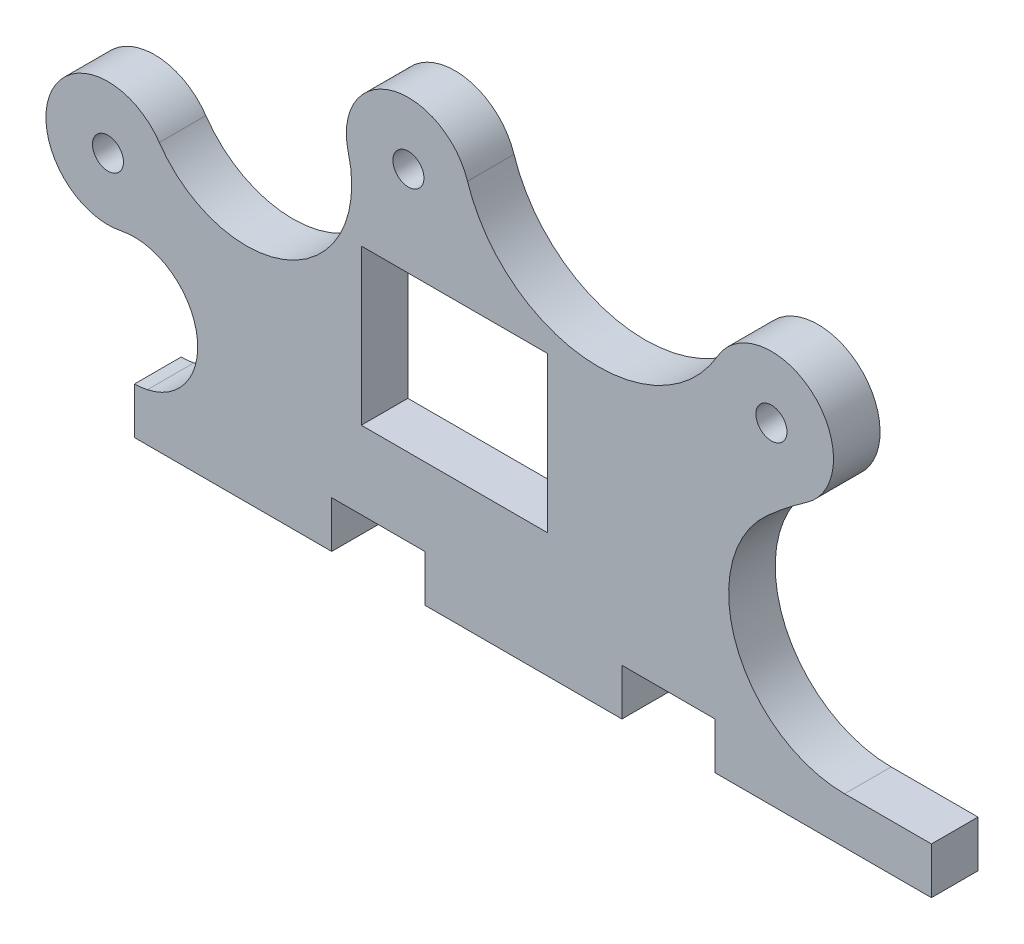
from build123d import *

# Parameters (mm, degrees)
SKETCH_2_R          = 1
SKETCH_2_W          = 12
SKETCH_2_H          = 10
EXTRUDE_1_DEPTH     = 3
SKETCH_3_W          = 67.5
SKETCH_3_H          = 19.05
CUT_EXTRUDE_1_DEPTH = 3
SKETCH_4_W          = 6
SKETCH_4_H          = 3
CUT_EXTRUDE_2_DEPTH = 3
CUT_EXTRUDE_START   = -3
CUT_EXTRUDE_3_DEPTH = 3


with BuildPart() as part:
    # 스케치2 → 보스-돌출1 (new body)
    with BuildSketch(Plane.XY):
        with BuildLine():
            Line((-25.485574715, -6.758293196), (31.501216284, -6.758293196))
            ThreePointArc((31.501216284, -6.758293196), (38.452055955, -4.004295945), (41.630451907, 2.763013133))
            ThreePointArc((41.630451907, 2.763013133), (34.930270172, 4.650120348), (27.980151111, 4.263527588))
            ThreePointArc((27.980151111, 4.263527588), (30.476148958, 15.174416231), (26.885608279, 25.775619647))
            ThreePointArc((26.885608279, 25.775619647), (19.196067088, 24.921345998), (12.532472084, 20.9900194))
            ThreePointArc((12.532472084, 20.9900194), (7.013386949, 25.131320034), (0.635, 27.763211294))
            ThreePointArc((0.635, 27.763211294), (-5.803216647, 23.07550321), (-10.623464465, 16.735909244))
            ThreePointArc((-10.623464465, 16.735909244), (-16.694266299, 18.270908366), (-22.954465563, 18.415))
            ThreePointArc((-22.954465563, 18.415), (-24.716513625, 12.803357438), (-25.333146618, 6.95398915))
            ThreePointArc((-25.333146618, 6.95398915), (-32.051736926, 6.951939733), (-37.86649166, 3.586217327))
            ThreePointArc((-37.86649166, 3.586217327), (-33.552420479, -3.831808304), (-25.485574715, -6.758293196))
        make_face()
        with Locations((-18.720080529, 13.97)):
            Circle(SKETCH_2_R, mode=Mode.SUBTRACT)
        with Locations((0.635, 22.758099244)):
            Circle(SKETCH_2_R, mode=Mode.SUBTRACT)
        with Locations((24.024354369, 20.291387406)):
            Circle(SKETCH_2_R, mode=Mode.SUBTRACT)
        with Locations((3.600778132, 11.95398915)):
            Rectangle(SKETCH_2_W, SKETCH_2_H, mode=Mode.SUBTRACT)
    extrude(amount=EXTRUDE_1_DEPTH)

    # 스케치3 → 컷-돌출1 (cut)
    with BuildSketch(Plane.XY.offset(3)):
        with Locations((0.583193505, -10.568293196)):
            Rectangle(SKETCH_3_W, SKETCH_3_H)
    extrude(amount=-CUT_EXTRUDE_1_DEPTH, mode=Mode.SUBTRACT)

    # 스케치4 → 컷-돌출2 (cut)
    with BuildSketch(Plane.XY.offset(3)):
        with Locations((-20.006806495, 0.456706804)):
            Rectangle(SKETCH_4_W, SKETCH_4_H)
        with Locations((17.393193505, 0.456706804)):
            Rectangle(SKETCH_4_W, SKETCH_4_H)
        with Locations((-1.306806495, 0.456706804)):
            Rectangle(SKETCH_4_W, SKETCH_4_H)
    extrude(amount=-CUT_EXTRUDE_2_DEPTH, mode=Mode.SUBTRACT)

    # 스케치6 → 컷-돌출3 (cut)
    with BuildSketch(Plane.XY.offset(3).offset(CUT_EXTRUDE_START)):
        with BuildLine():
            Line((-17.006806495, 1.956706804), (-23.006806495, 1.956706804))
            Line((-23.006806495, 1.956706804), (-23.006806495, -1.043293196))
            Line((-23.006806495, -1.043293196), (-33.166806495, -1.043293196))
            Line((-33.166806495, -1.043293196), (-33.166806495, -4.141334476))
            ThreePointArc((-33.166806495, -4.141334476), (-36.235049915, -0.71447027), (-37.86649166, 3.586217327))
            ThreePointArc((-37.86649166, 3.586217327), (-32.051736926, 6.951939733), (-25.333146618, 6.95398915))
            ThreePointArc((-25.333146618, 6.95398915), (-24.716513625, 12.803357438), (-22.954465563, 18.415))
            ThreePointArc((-22.954465563, 18.415), (-16.694266299, 18.270908366), (-10.623464465, 16.735909244))
            ThreePointArc((-10.623464465, 16.735909244), (-5.803216647, 23.07550321), (0.635, 27.763211294))
            ThreePointArc((0.635, 27.763211294), (7.013386949, 25.131320034), (12.532472084, 20.9900194))
            ThreePointArc((12.532472084, 20.9900194), (19.196067088, 24.921345998), (26.885608279, 25.775619647))
            ThreePointArc((26.885608279, 25.775619647), (30.476148958, 15.174416231), (27.980151111, 4.263527588))
            ThreePointArc((27.980151111, 4.263527588), (34.930270172, 4.650120348), (41.630451907, 2.763013133))
            ThreePointArc((41.630451907, 2.763013133), (39.424820657, -2.950900295), (34.333193505, -6.355154812))
            Line((34.333193505, -6.355154812), (34.333193505, -1.043293196))
            Line((34.333193505, -1.043293196), (34.333193505, 1.956706804))
            Line((34.333193505, 1.956706804), (28.736134873, 1.956706804))
            ThreePointArc((28.736134873, 1.956706804), (21.761064735, 6.755645136), (23.749798637, 14.985247192))
            ThreePointArc((23.749798637, 14.985247192), (24.996231791, 16.035094284), (26.305425054, 17.005551662))
            ThreePointArc((26.305425054, 17.005551662), (26.732453483, 23.235228296), (20.559975673, 22.290907411))
            ThreePointArc((20.559975673, 22.290907411), (11.947819263, 17.903967637), (4.440273192, 23.99093984))
            ThreePointArc((4.440273192, 23.99093984), (-0.484844776, 26.598144514), (-3.236462793, 21.752228554))
            ThreePointArc((-3.236462793, 21.752228554), (-6.999770707, 13.865014257), (-15.414747401, 16.222725663))
            ThreePointArc((-15.414747401, 16.222725663), (-20.472957028, 17.565472706), (-22.530630542, 12.753567266))
            ThreePointArc((-22.530630542, 12.753567266), (-20.728909441, 10.511010783), (-17.88821468, 10.057456172))
            ThreePointArc((-17.88821468, 10.057456172), (-13.029100566, 6.902297391), (-16.184259346, 2.043183277))
            ThreePointArc((-16.184259346, 2.043183277), (-16.593266293, 1.978385333), (-17.006806495, 1.956706804))
        make_face()
    extrude(amount=CUT_EXTRUDE_3_DEPTH, mode=Mode.SUBTRACT)


solid = part.part
